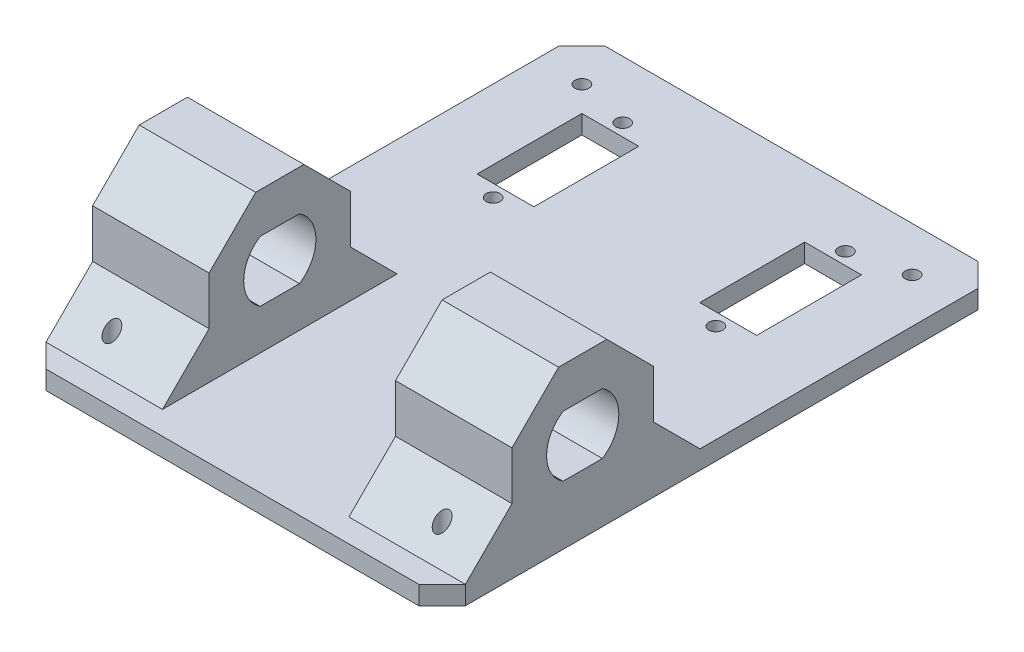
from build123d import *

# Parameters (mm, degrees)
SKETCH1_W                            = 90
SKETCH1_H                            = 120
BOSS_EXTRUDE2_DEPTH                  = 4
SKETCH5_W                            = 12.2
SKETCH5_H                            = 22.5
CUT_EXTRUDE1_DEPTH                   = 76.106590923
BOSS_EXTRUDE4_START                  = 45
SKETCH10_W                           = 30.35
SKETCH10_H                           = 30.35
SKETCH10_R                           = 7.75
BOSS_EXTRUDE4_DEPTH                  = 25
BOSS_EXTRUDE5_START                  = -20
SKETCH10_4_W                         = 30.35
SKETCH10_4_H                         = 30.35
SKETCH10_4_R                         = 7.75
BOSS_EXTRUDE5_DEPTH                  = 25
CHAMFER6_SIZE                        = 5
CHAMFER7_SIZE                        = 10
F_3_0_3_DIAMETER_HOLE2_D             = 3
MIRROR9_AT_THE_SECOND_PLANE_COPY_1_D = 3
F_3_0_3_DIAMETER_HOLE3_D             = 3


with BuildPart() as part:
    # Sketch1 → Boss-Extrude2 (new body)
    with BuildSketch(Plane(origin=(0, 0, 0), x_dir=(1, 0, 0), z_dir=(0, 1, 0))):
        Rectangle(SKETCH1_W, SKETCH1_H)
    extrude(amount=BOSS_EXTRUDE2_DEPTH)

    # Sketch5 → Cut-Extrude1 (cut, through all)
    with BuildSketch(Plane(origin=(0, 4, 0), x_dir=(1, 0, 0), z_dir=(0, 1, 0))):
        with Locations((-23.9, 33.75)):
            Rectangle(SKETCH5_W, SKETCH5_H)
        with Locations((23.9, 33.75)):
            Rectangle(SKETCH5_W, SKETCH5_H)
    extrude(amount=-CUT_EXTRUDE1_DEPTH, mode=Mode.SUBTRACT)

    # Sketch10 → Boss-Extrude4 (add)
    # profile 1 of 3: a face of its own
    with BuildSketch(Plane(origin=(0, 0, 0), x_dir=(0, 0, -1), z_dir=(1, 0, 0)).offset(BOSS_EXTRUDE4_START)):
        with Locations((-29.825, 19.175)):
            Rectangle(SKETCH10_W, SKETCH10_H)
        with Locations((-29.825, 19.175)):
            Circle(SKETCH10_R, mode=Mode.SUBTRACT)
    # profile 2 of 3: a face of its own
    with BuildSketch(Plane(origin=(0, 0, 0), x_dir=(0, 0, -1), z_dir=(1, 0, 0)).offset(BOSS_EXTRUDE4_START)):
        with BuildLine():
            ThreePointArc((-25.604514246, 25.675), (-29.825, 26.925), (-34.045485754, 25.675))
            Line((-34.045485754, 25.675), (-25.604514246, 25.675))
        make_face()
    # profile 3 of 3: a face of its own
    with BuildSketch(Plane(origin=(0, 0, 0), x_dir=(0, 0, -1), z_dir=(1, 0, 0)).offset(BOSS_EXTRUDE4_START)):
        with BuildLine():
            Line((-25.604514246, 12.675), (-34.045485754, 12.675))
            ThreePointArc((-34.045485754, 12.675), (-29.825, 11.425), (-25.604514246, 12.675))
        make_face()
    extrude(amount=-BOSS_EXTRUDE4_DEPTH)

    # Sketch10<4> → Boss-Extrude5 (add)
    # profile 1 of 3: a face of its own
    with BuildSketch(Plane(origin=(0, 0, 0), x_dir=(0, 0, -1), z_dir=(1, 0, 0)).offset(BOSS_EXTRUDE5_START)):
        with Locations((-29.825, 19.175)):
            Rectangle(SKETCH10_4_W, SKETCH10_4_H)
        with Locations((-29.825, 19.175)):
            Circle(SKETCH10_4_R, mode=Mode.SUBTRACT)
    # profile 2 of 3: a face of its own
    with BuildSketch(Plane(origin=(0, 0, 0), x_dir=(0, 0, -1), z_dir=(1, 0, 0)).offset(BOSS_EXTRUDE5_START)):
        with BuildLine():
            ThreePointArc((-25.604514246, 25.675), (-29.825, 26.925), (-34.045485754, 25.675))
            Line((-34.045485754, 25.675), (-25.604514246, 25.675))
        make_face()
    # profile 3 of 3: a face of its own
    with BuildSketch(Plane(origin=(0, 0, 0), x_dir=(0, 0, -1), z_dir=(1, 0, 0)).offset(BOSS_EXTRUDE5_START)):
        with BuildLine():
            Line((-25.604514246, 12.675), (-34.045485754, 12.675))
            ThreePointArc((-34.045485754, 12.675), (-29.825, 11.425), (-25.604514246, 12.675))
        make_face()
    extrude(amount=-BOSS_EXTRUDE5_DEPTH)

    # Chamfer6
    chamfer6_edges = [part.edges().sort_by_distance(p)[0] for p in [
        (-45, 2, 60),
        (-45, 2, -60),
        (45, 2, -60),
        (45, 2, 60),
    ]]
    chamfer(chamfer6_edges, length=CHAMFER6_SIZE)

    # Chamfer7
    chamfer7_edges = [part.edges().sort_by_distance(p)[0] for p in [
        (32.5, 4, 45),
        (32.5, 34.35, 45),
        (32.5, 34.35, 14.65),
        (32.5, 4, 14.65),
        (-32.5, 34.35, 45),
        (-32.5, 4, 45),
        (-32.5, 4, 14.65),
        (-32.5, 34.35, 14.65),
    ]]
    chamfer(chamfer7_edges, length=CHAMFER7_SIZE)

    # Ø3.0 (3) Diameter Hole2 (through all)
    with Locations(Plane.XZ):
        with Locations((-35.428932188, 50.428932188)):
            f_3_0_3_diameter_hole2 = Hole(F_3_0_3_DIAMETER_HOLE2_D / 2)

    # Mirror9: Ø3.0 (3) Diameter Hole2 across plane
    add(f_3_0_3_diameter_hole2.mirror(Plane.XY), mode=Mode.SUBTRACT)

    # Mirror9 at the second plane: Ø3.0 (3) Diameter Hole2 across plane
    add(f_3_0_3_diameter_hole2.mirror(Plane(origin=(0, 0, 0), x_dir=(0, 0, 1), z_dir=(1, 0, 0))), mode=Mode.SUBTRACT)

    # Mirror9 at the second plane copy 1 (through all)
    with Locations(Plane(origin=(0, 0, 0), x_dir=(-1, 0, 0), z_dir=(0, -1, 0))):
        with Locations((-35.428932188, 50.428932188)):
            Hole(MIRROR9_AT_THE_SECOND_PLANE_COPY_1_D / 2)

    # Ø3.0 (3) Diameter Hole3 (through all)
    with Locations(Plane.XZ):
        with Locations((-23.9, -19.85), (-23.9, -47.65)):
            f_3_0_3_diameter_hole3 = Hole(F_3_0_3_DIAMETER_HOLE3_D / 2)

    # Mirror10: Ø3.0 (3) Diameter Hole3 across plane
    add(f_3_0_3_diameter_hole3.mirror(Plane(origin=(0, 0, 0), x_dir=(0, 0, 1), z_dir=(1, 0, 0))), mode=Mode.SUBTRACT)


solid = part.part
